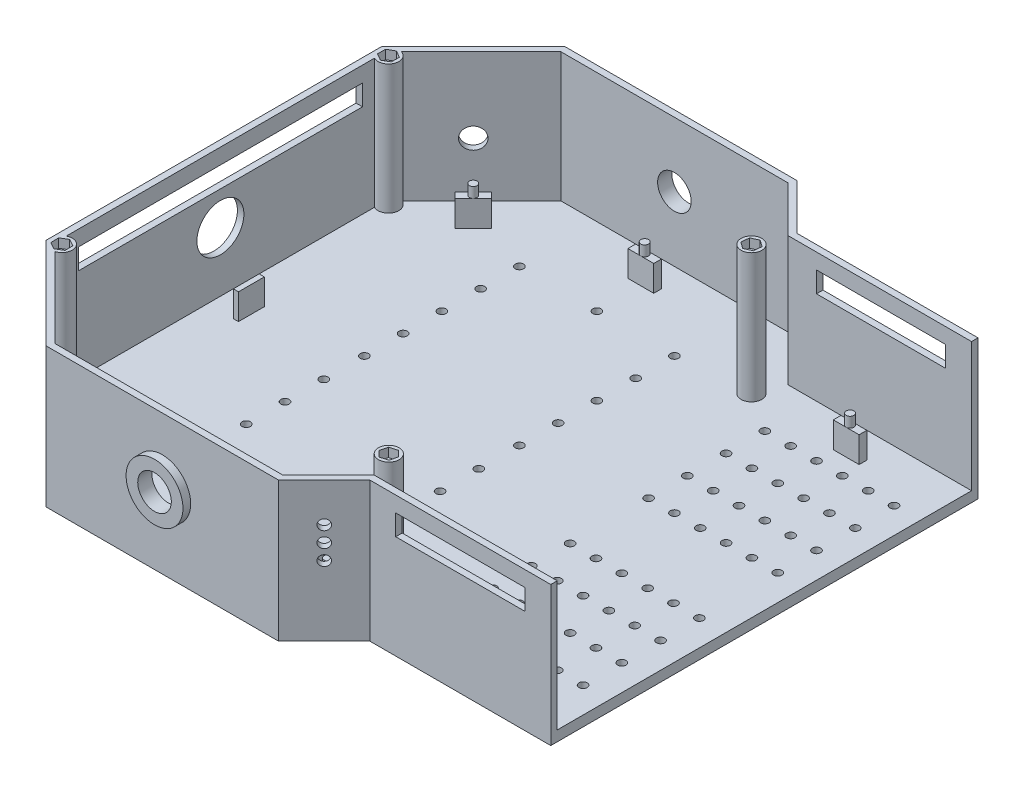
from build123d import *

# Parameters (mm, degrees)
Y_KSEKLIK_EKSTR_ZYON1_DEPTH = 4
Y_KSEKLIK_EKSTR_ZYON2_DEPTH = 50
IZIM3_R                     = 4.05
KES_EKSTR_ZYON1_DEPTH       = 50
IZIM4_R                     = 4.05
KES_EKSTR_ZYON2_DEPTH       = 50
IZIM7_W                     = 10
IZIM7_H                     = 3
IZIM7_W_2                   = 2
IZIM7_H_2                   = 10
Y_KSEKLIK_EKSTR_ZYON3_DEPTH = 10
IZIM8_R                     = 11
Y_KSEKLIK_EKSTR_ZYON5_DEPTH = 3
Y_KSEKLIK_EKSTR_ZYON6_START = 3
IZIM9_R                     = 11
Y_KSEKLIK_EKSTR_ZYON6_DEPTH = 3
IZIM11_R                    = 6.5
KES_EKSTR_ZYON4_DEPTH       = 232
IZIM12_R                    = 1.6
KES_EKSTR_ZYON5_DEPTH       = 10
IZIM13_R                    = 1.6
KES_EKSTR_ZYON6_DEPTH       = 10
IZIM14_R                    = 9.1
KES_EKSTR_ZYON7_DEPTH       = 10
IZIM15_W                    = 50
IZIM15_H                    = 8
KES_EKSTR_ZYON8_DEPTH       = 190
IZIM16_R                    = 4
Y_KSEKLIK_EKSTR_ZYON7_DEPTH = 50
IZIM17_R                    = 1.6
KES_EKSTR_ZYON9_DEPTH       = 190
KES_EKSTR_ZYON10_DEPTH      = 3.5
IZIM19_R                    = 1.5
Y_KSEKLIK_EKSTR_ZYON8_DEPTH = 14
IZIM20_R                    = 2
KES_EKSTR_ZYON11_DEPTH      = 14
IZIM21_R                    = 2
KES_EKSTR_ZYON12_DEPTH      = 14


with BuildPart() as part:
    # Çizim1 → Yükseklik-Ekstrüzyon1 (new body)
    with BuildSketch(Plane(origin=(0, 0, 0), x_dir=(1, 0, 0), z_dir=(0, 1, 0))):
        Polygon((-93.907506655, 105.577086382), (-129.262845715, 70.221747322), (-129.262845715, -59.778252678), (-93.907506655, -95.133591737), (-3.907506655, -95.133591737), (13.770162874, -77.455922207), (83.770162874, -77.455922207), (83.770162874, 87.899416852), (13.770162874, 87.899416852), (-3.907506655, 105.577086382), align=None)
    extrude(amount=Y_KSEKLIK_EKSTR_ZYON1_DEPTH)

    # Çizim2 → Yükseklik-Ekstrüzyon2 (add)
    with BuildSketch(Plane(origin=(0, 4, 0), x_dir=(1, 0, 0), z_dir=(0, 1, 0))):
        Polygon((83.770162874, 87.899416852), (13.770162874, 87.899416852), (-3.907506655, 105.577086382), (-93.907506655, 105.577086382), (-129.262845715, 70.221747322), (-129.262845715, -59.778252678), (-93.907506655, -95.133591737), (-3.907506655, -95.133591737), (13.770162874, -77.455922207), (83.770162874, -77.455922207), (83.770162874, -74.955922207), (12.734628968, -74.955922207), (-4.943040561, -92.633591737), (-92.871972749, -92.633591737), (-126.762845715, -58.742718772), (-126.762845715, 69.186213416), (-92.871972749, 103.077086382), (-4.943040561, 103.077086382), (12.734628968, 85.399416852), (83.770162874, 85.399416852), align=None)
    extrude(amount=Y_KSEKLIK_EKSTR_ZYON2_DEPTH)

    # Çizim3 → Kes-Ekstrüzyon1 (cut)
    with BuildSketch(Plane(origin=(-94.520549196, 0, 94.520549196), x_dir=(0.7071067811865475, 0, 0.7071067811865477), z_dir=(-0.7071067811865477, 0, 0.7071067811865475))):
        with Locations((-24.133026924, 25)):
            Circle(IZIM3_R)
    extrude(amount=-KES_EKSTR_ZYON1_DEPTH, mode=Mode.SUBTRACT)

    # Çizim4 → Kes-Ekstrüzyon2 (cut)
    with BuildSketch(Plane(origin=(-99.742296518, 0, -99.742296518), x_dir=(-0.7071067811865474, 0, 0.7071067811865477), z_dir=(-0.7071067811865477, 0, -0.7071067811865474))):
        with Locations((16.748361042, 25)):
            Circle(IZIM4_R)
    extrude(amount=-KES_EKSTR_ZYON2_DEPTH, mode=Mode.SUBTRACT)

    # Çizim7 → Yükseklik-Ekstrüzyon3 (add)
    with BuildSketch(Plane(origin=(0, 4, 0), x_dir=(1, 0, 0), z_dir=(0, 1, 0))):
        with Locations((48.252395921, 73.899416852)):
            Rectangle(IZIM7_W, IZIM7_H)
        Polygon((-6.710807514, 90.702717711), (0.360260298, 83.631649899), (-1.761060046, 81.510329555), (-8.832127858, 88.581397367), align=None)
        with Locations((-48.907506655, 91.577086382)):
            Rectangle(IZIM7_W, IZIM7_H)
        Polygon((-106.281875326, 75.525048181), (-99.210807514, 82.596115993), (-97.089487171, 80.474795649), (-104.160554983, 73.403727838), align=None)
        with Locations((-115.762845715, 5.221747322)):
            Rectangle(IZIM7_W_2, IZIM7_H_2)
        with Locations((48.252395921, -63.455922207)):
            Rectangle(IZIM7_W, IZIM7_H)
        Polygon((0.360260298, -73.188155254), (-1.761060046, -71.066834911), (-8.832127858, -78.137902723), (-6.710807514, -80.259223066), align=None)
        with Locations((-48.907506655, -81.133591737)):
            Rectangle(IZIM7_W, IZIM7_H)
        Polygon((-104.160554983, -62.960233193), (-106.281875326, -65.081553537), (-99.210807514, -72.152621349), (-97.089487171, -70.031301005), align=None)
    extrude(amount=Y_KSEKLIK_EKSTR_ZYON3_DEPTH)

    # Çizim8 → Yükseklik-Ekstrüzyon5 (add)
    with BuildSketch(Plane.XY.offset(95.133591737)):
        with Locations((-48.907506655, 29)):
            Circle(IZIM8_R)
    extrude(amount=Y_KSEKLIK_EKSTR_ZYON5_DEPTH)

    # Çizim9 → Yükseklik-Ekstrüzyon6 (add)
    with BuildSketch(Plane(origin=(0, 0, -105.577086382), x_dir=(-1, 0, 0), z_dir=(0, 0, -1)).offset(Y_KSEKLIK_EKSTR_ZYON6_START)):
        with Locations(Location((48.907506655, 29, 0), (0, 0, 180))):
            Circle(IZIM9_R)
    extrude(amount=-Y_KSEKLIK_EKSTR_ZYON6_DEPTH)

    # Çizim11 → Kes-Ekstrüzyon4 (cut)
    with BuildSketch(Plane(origin=(0, 0, -108.577086382), x_dir=(-1, 0, 0), z_dir=(0, 0, -1))):
        with Locations((48.907506655, 29)):
            Circle(IZIM11_R)
    extrude(amount=-KES_EKSTR_ZYON4_DEPTH, mode=Mode.SUBTRACT)

    # Çizim12 → Kes-Ekstrüzyon5 (cut)
    with BuildSketch(Plane(origin=(0, 4, 0), x_dir=(1, 0, 0), z_dir=(0, 1, 0))):
        with Locations(Location((-78.907506655, 73.077086382, 0), (0, 0, 270))):
            Circle(IZIM12_R)
        with Locations(Location((-18.907506655, 73.077086382, 0), (0, 0, 270))):
            Circle(IZIM12_R)
        with Locations(Location((-18.907506655, 58.077086382, 0), (0, 0, 270))):
            Circle(IZIM12_R)
        with Locations(Location((-18.907506655, 43.077086382, 0), (0, 0, 270))):
            Circle(IZIM12_R)
        with Locations(Location((-18.907506655, 28.077086382, 0), (0, 0, 270))):
            Circle(IZIM12_R)
        with Locations(Location((-18.907506655, 13.077086382, 0), (0, 0, 270))):
            Circle(IZIM12_R)
        with Locations(Location((-18.907506655, -2.633591737, 0), (0, 0, 270))):
            Circle(IZIM12_R)
        with Locations(Location((-18.907506655, -17.633591737, 0), (0, 0, 270))):
            Circle(IZIM12_R)
        with Locations(Location((-18.907506655, -32.633591737, 0), (0, 0, 270))):
            Circle(IZIM12_R)
        with Locations(Location((-18.907506655, -47.633591737, 0), (0, 0, 270))):
            Circle(IZIM12_R)
        with Locations(Location((-78.907506655, -47.633591737, 0), (0, 0, 270))):
            Circle(IZIM12_R)
        with Locations(Location((-78.907506655, -62.633591737, 0), (0, 0, 270))):
            Circle(IZIM12_R)
        with Locations(Location((-18.907506655, -62.633591737, 0), (0, 0, 270))):
            Circle(IZIM12_R)
        with Locations(Location((-78.907506655, 58.077086382, 0), (0, 0, 270))):
            Circle(IZIM12_R)
        with Locations(Location((-78.907506655, 43.077086382, 0), (0, 0, 270))):
            Circle(IZIM12_R)
        with Locations(Location((-78.907506655, 28.077086382, 0), (0, 0, 270))):
            Circle(IZIM12_R)
        with Locations(Location((-78.907506655, 13.077086382, 0), (0, 0, 270))):
            Circle(IZIM12_R)
        with Locations(Location((-78.907506655, -2.633591737, 0), (0, 0, 270))):
            Circle(IZIM12_R)
        with Locations(Location((-78.907506655, -17.633591737, 0), (0, 0, 270))):
            Circle(IZIM12_R)
        with Locations(Location((-78.907506655, -32.633591737, 0), (0, 0, 270))):
            Circle(IZIM12_R)
        with Locations(Location((-48.907506655, -62.633591737, 0), (0, 0, 270))):
            Circle(IZIM12_R)
        with Locations(Location((-48.907506655, 73.077086382, 0), (0, 0, 270))):
            Circle(IZIM12_R)
    extrude(amount=-KES_EKSTR_ZYON5_DEPTH, mode=Mode.SUBTRACT)

    # Çizim13 → Kes-Ekstrüzyon6 (cut)
    with BuildSketch(Plane(origin=(0, 4, 0), x_dir=(1, 0, 0), z_dir=(0, 1, 0))):
        with Locations(Location((73.770162874, 65.399416852, 0), (0, 0, 270))):
            Circle(IZIM13_R)
        with Locations(Location((63.770162874, 65.399416852, 0), (0, 0, 270))):
            Circle(IZIM13_R)
        with Locations(Location((53.770162874, 65.399416852, 0), (0, 0, 270))):
            Circle(IZIM13_R)
        with Locations(Location((43.770162874, 65.399416852, 0), (0, 0, 270))):
            Circle(IZIM13_R)
        with Locations(Location((33.770162874, 65.399416852, 0), (0, 0, 270))):
            Circle(IZIM13_R)
        with Locations(Location((23.770162874, 65.399416852, 0), (0, 0, 270))):
            Circle(IZIM13_R)
        with Locations(Location((23.770162874, 50.399416852, 0), (0, 0, 270))):
            Circle(IZIM13_R)
        with Locations(Location((33.770162874, 50.399416852, 0), (0, 0, 270))):
            Circle(IZIM13_R)
        with Locations(Location((43.770162874, 50.399416852, 0), (0, 0, 270))):
            Circle(IZIM13_R)
        with Locations(Location((53.770162874, 50.399416852, 0), (0, 0, 270))):
            Circle(IZIM13_R)
        with Locations(Location((63.770162874, 50.399416852, 0), (0, 0, 270))):
            Circle(IZIM13_R)
        with Locations(Location((73.770162874, 50.399416852, 0), (0, 0, 270))):
            Circle(IZIM13_R)
        with Locations(Location((53.770162874, 35.399416852, 0), (0, 0, 90))):
            Circle(IZIM13_R)
        with Locations(Location((63.770162874, 35.399416852, 0), (0, 0, 90))):
            Circle(IZIM13_R)
        with Locations(Location((73.770162874, 35.399416852, 0), (0, 0, 90))):
            Circle(IZIM13_R)
        with Locations(Location((73.770162874, 20.399416852, 0), (0, 0, 90))):
            Circle(IZIM13_R)
        with Locations(Location((63.770162874, 20.399416852, 0), (0, 0, 90))):
            Circle(IZIM13_R)
        with Locations(Location((53.770162874, 20.399416852, 0), (0, 0, 90))):
            Circle(IZIM13_R)
        with Locations(Location((43.770162874, 20.399416852, 0), (0, 0, 90))):
            Circle(IZIM13_R)
        with Locations(Location((43.770162874, 35.399416852, 0), (0, 0, 90))):
            Circle(IZIM13_R)
        with Locations(Location((33.770162874, 35.399416852, 0), (0, 0, 90))):
            Circle(IZIM13_R)
        with Locations(Location((33.770162874, 20.399416852, 0), (0, 0, 90))):
            Circle(IZIM13_R)
        with Locations(Location((23.770162874, 20.399416852, 0), (0, 0, 90))):
            Circle(IZIM13_R)
        with Locations(Location((23.770162874, 35.399416852, 0), (0, 0, 90))):
            Circle(IZIM13_R)
        with Locations(Location((23.770162874, -24.955922207, 0), (0, 0, 270))):
            Circle(IZIM13_R)
        with Locations(Location((23.770162874, -9.955922207, 0), (0, 0, 270))):
            Circle(IZIM13_R)
        with Locations(Location((33.770162874, -9.955922207, 0), (0, 0, 270))):
            Circle(IZIM13_R)
        with Locations(Location((33.770162874, -24.955922207, 0), (0, 0, 270))):
            Circle(IZIM13_R)
        with Locations(Location((43.770162874, -24.955922207, 0), (0, 0, 270))):
            Circle(IZIM13_R)
        with Locations(Location((43.770162874, -9.955922207, 0), (0, 0, 270))):
            Circle(IZIM13_R)
        with Locations(Location((53.770162874, -9.955922207, 0), (0, 0, 270))):
            Circle(IZIM13_R)
        with Locations(Location((63.770162874, -9.955922207, 0), (0, 0, 270))):
            Circle(IZIM13_R)
        with Locations(Location((73.770162874, -9.955922207, 0), (0, 0, 270))):
            Circle(IZIM13_R)
        with Locations(Location((73.770162874, -24.955922207, 0), (0, 0, 270))):
            Circle(IZIM13_R)
        with Locations(Location((63.770162874, -24.955922207, 0), (0, 0, 270))):
            Circle(IZIM13_R)
        with Locations(Location((53.770162874, -24.955922207, 0), (0, 0, 270))):
            Circle(IZIM13_R)
        with Locations(Location((73.770162874, -39.955922207, 0), (0, 0, 90))):
            Circle(IZIM13_R)
        with Locations(Location((63.770162874, -39.955922207, 0), (0, 0, 90))):
            Circle(IZIM13_R)
        with Locations(Location((53.770162874, -39.955922207, 0), (0, 0, 90))):
            Circle(IZIM13_R)
        with Locations(Location((43.770162874, -39.955922207, 0), (0, 0, 90))):
            Circle(IZIM13_R)
        with Locations(Location((33.770162874, -39.955922207, 0), (0, 0, 90))):
            Circle(IZIM13_R)
        with Locations(Location((23.770162874, -39.955922207, 0), (0, 0, 90))):
            Circle(IZIM13_R)
        with Locations(Location((23.770162874, -54.955922207, 0), (0, 0, 90))):
            Circle(IZIM13_R)
        with Locations(Location((33.770162874, -54.955922207, 0), (0, 0, 90))):
            Circle(IZIM13_R)
        with Locations(Location((43.770162874, -54.955922207, 0), (0, 0, 90))):
            Circle(IZIM13_R)
        with Locations(Location((53.770162874, -54.955922207, 0), (0, 0, 90))):
            Circle(IZIM13_R)
        with Locations(Location((63.770162874, -54.955922207, 0), (0, 0, 90))):
            Circle(IZIM13_R)
        with Locations(Location((73.770162874, -54.955922207, 0), (0, 0, 90))):
            Circle(IZIM13_R)
    extrude(amount=-KES_EKSTR_ZYON6_DEPTH, mode=Mode.SUBTRACT)

    # Çizim14 → Kes-Ekstrüzyon7 (cut)
    with BuildSketch(Plane.ZY.offset(129.262845715)):
        Polygon((-60.221747322, 40), (49.778252678, 40), (49.778252678, 44), (49.778252678, 48), (-60.221747322, 48), (-60.221747322, 44), align=None)
        with Locations((-5.221747322, 27)):
            Circle(IZIM14_R)
    extrude(amount=-KES_EKSTR_ZYON7_DEPTH, mode=Mode.SUBTRACT)

    # Çizim15 → Kes-Ekstrüzyon8 (cut)
    with BuildSketch(Plane.XY.offset(77.455922207)):
        with Locations((48.770162874, 44)):
            Rectangle(IZIM15_W, IZIM15_H)
    extrude(amount=-KES_EKSTR_ZYON8_DEPTH, mode=Mode.SUBTRACT)

    # Çizim16 → Yükseklik-Ekstrüzyon7 (add)
    with BuildSketch(Plane(origin=(0, 4, 0), x_dir=(1, 0, 0), z_dir=(0, 1, 0))):
        with Locations(Location((8.592493345, 75.399416852, 0), (0, 0, 90))):
            Circle(IZIM16_R)
        with Locations((-124.91508665, 68.420846552)):
            Circle(IZIM16_R)
        with Locations((-124.91508665, -57.977351907)):
            Circle(IZIM16_R)
        with Locations(Location((8.592493345, -64.955922207, 0), (0, 0, 90))):
            Circle(IZIM16_R)
    extrude(amount=Y_KSEKLIK_EKSTR_ZYON7_DEPTH)

    # Çizim17 → Kes-Ekstrüzyon9 (cut)
    with BuildSketch(Plane(origin=(0, 54, 0), x_dir=(1, 0, 0), z_dir=(0, 1, 0))):
        with Locations(Location((-124.91508665, 68.420846552, 0), (0, 0, 270))):
            Circle(IZIM17_R)
        with Locations(Location((-124.91508665, -57.977351907, 0), (0, 0, 270))):
            Circle(IZIM17_R)
        with Locations(Location((8.592493345, 75.399416852, 0), (0, 0, 270))):
            Circle(IZIM17_R)
        with Locations(Location((8.592493345, -64.955922207, 0), (0, 0, 270))):
            Circle(IZIM17_R)
    extrude(amount=-KES_EKSTR_ZYON9_DEPTH, mode=Mode.SUBTRACT)

    # Çizim18 → Kes-Ekstrüzyon10 (cut)
    with BuildSketch(Plane(origin=(0, 54, 0), x_dir=(1, 0, 0), z_dir=(0, 1, 0))):
        Polygon((-122.239727613, 66.854815255), (-122.221184245, 69.954759794), (-124.896543282, 71.52079109), (-127.590445687, 69.986877848), (-127.608989054, 66.88693331), (-124.933630017, 65.320902013), align=None)
        Polygon((-122.198371365, -59.470488895), (-122.263634445, -56.37117595), (-124.980349729, -54.878038962), (-127.631801934, -56.48421492), (-127.566538854, -59.583527865), (-124.84982357, -61.076664852), align=None)
        Polygon((10.820187794, -67.111699895), (11.573298812, -64.104571066), (9.345604363, -61.948793378), (6.364798895, -62.800144519), (5.611687877, -65.807273349), (7.839382327, -67.963051036), align=None)
        Polygon((11.110359734, 73.591006267), (11.417556047, 76.675747816), (8.899689657, 78.484158401), (6.074626955, 77.207827437), (5.767430643, 74.123085888), (8.285297032, 72.314675303), align=None)
    extrude(amount=-KES_EKSTR_ZYON10_DEPTH, mode=Mode.SUBTRACT)

    # Çizim19 → Yükseklik-Ekstrüzyon8 (add)
    with BuildSketch(Plane(origin=(0, 4, 0), x_dir=(1, 0, 0), z_dir=(0, 1, 0))):
        with Locations(Location((-101.685681248, 77.999921915, 0), (0, 0, 135))):
            Circle(IZIM19_R)
        with Locations(Location((-101.685681248, -67.556427271, 0), (0, 0, 45))):
            Circle(IZIM19_R)
        with Locations(Location((-48.907506655, -81.133591737, 0), (0, 0, 270))):
            Circle(IZIM19_R)
        with Locations(Location((-4.23593378, -75.663028989, 0), (0, 0, 135))):
            Circle(IZIM19_R)
        with Locations(Location((48.252395921, -63.455922207, 0), (0, 0, 270))):
            Circle(IZIM19_R)
        with Locations(Location((-48.907506655, 91.577086382, 0), (0, 0, 270))):
            Circle(IZIM19_R)
        with Locations(Location((-4.23593378, 86.106523633, 0), (0, 0, 45))):
            Circle(IZIM19_R)
        with Locations(Location((48.252395921, 73.899416852, 0), (0, 0, 270))):
            Circle(IZIM19_R)
    extrude(amount=Y_KSEKLIK_EKSTR_ZYON8_DEPTH)

    # Çizim20 → Kes-Ekstrüzyon11 (cut)
    with BuildSketch(Plane(origin=(45.613042541, 0, 45.613042541), x_dir=(0.7071067811865477, 0, -0.7071067811865474), z_dir=(0.7071067811865474, 0, 0.7071067811865477))):
        with Locations((-57.532632289, 39)):
            Circle(IZIM20_R)
        with Locations((-57.532632289, 33)):
            Circle(IZIM20_R)
        with Locations((-57.532632289, 27)):
            Circle(IZIM20_R)
    extrude(amount=-KES_EKSTR_ZYON11_DEPTH, mode=Mode.SUBTRACT)

    # Çizim21 → Kes-Ekstrüzyon12 (cut)
    with BuildSketch(Plane(origin=(50.834789863, 0, -50.834789863), x_dir=(-0.7071067811865474, 0, -0.7071067811865477), z_dir=(0.7071067811865477, 0, -0.7071067811865474))):
        with Locations((64.917298172, 39)):
            Circle(IZIM21_R)
        with Locations((64.917298172, 33)):
            Circle(IZIM21_R)
        with Locations((64.917298172, 27)):
            Circle(IZIM21_R)
    extrude(amount=-KES_EKSTR_ZYON12_DEPTH, mode=Mode.SUBTRACT)


solid = part.part
